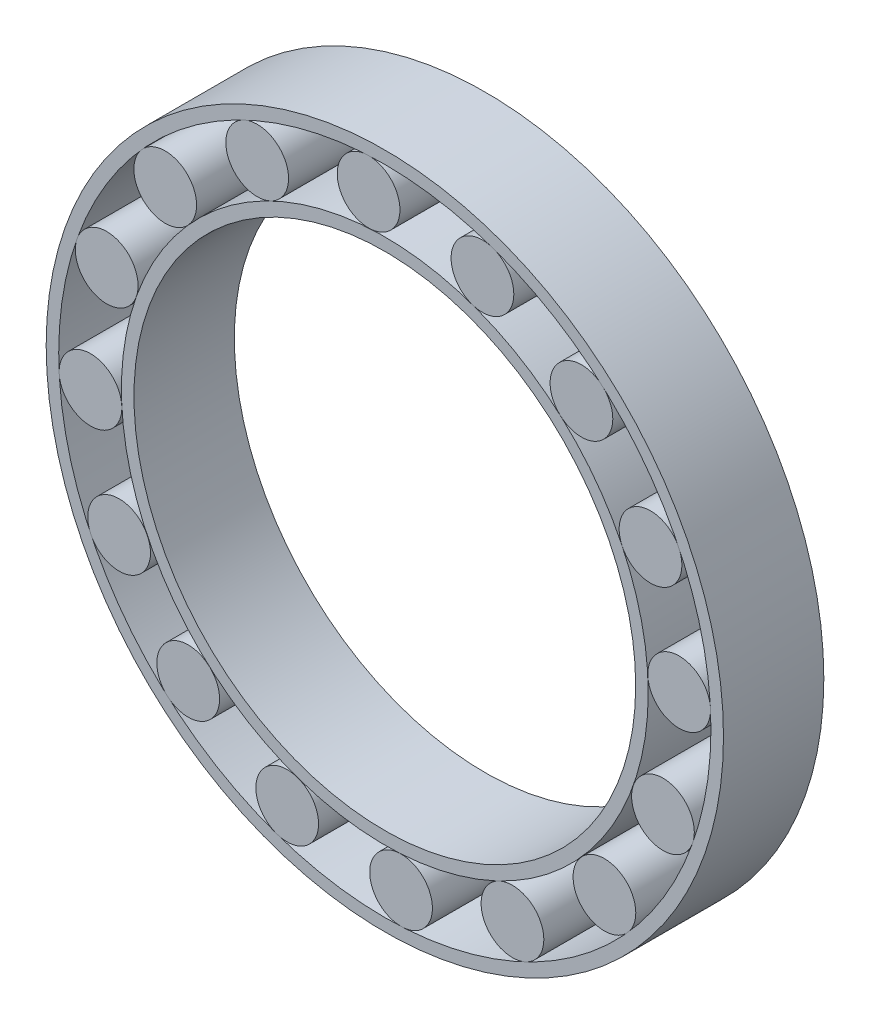
from build123d import *

# Parameters (mm, degrees)
IZIM1_R                        = 13.5
Y_KSEKLIK_EKSTR_ZYON1_DEPTH    = 4
Y_KSEKLIK_EKSTR_ZYON1_2_DEPTH  = 4
Y_KSEKLIK_EKSTR_ZYON1_3_DEPTH  = 4
Y_KSEKLIK_EKSTR_ZYON1_4_DEPTH  = 4
IZIM1_R_2                      = 10
Y_KSEKLIK_EKSTR_ZYON1_5_DEPTH  = 4
Y_KSEKLIK_EKSTR_ZYON1_6_DEPTH  = 4
Y_KSEKLIK_EKSTR_ZYON1_7_DEPTH  = 4
Y_KSEKLIK_EKSTR_ZYON1_8_DEPTH  = 4
Y_KSEKLIK_EKSTR_ZYON1_9_DEPTH  = 4
Y_KSEKLIK_EKSTR_ZYON1_10_DEPTH = 4
Y_KSEKLIK_EKSTR_ZYON1_11_DEPTH = 4
Y_KSEKLIK_EKSTR_ZYON1_12_DEPTH = 4
Y_KSEKLIK_EKSTR_ZYON1_13_DEPTH = 4
Y_KSEKLIK_EKSTR_ZYON1_14_DEPTH = 4
Y_KSEKLIK_EKSTR_ZYON1_15_DEPTH = 4
Y_KSEKLIK_EKSTR_ZYON1_16_DEPTH = 4
Y_KSEKLIK_EKSTR_ZYON1_17_DEPTH = 4
Y_KSEKLIK_EKSTR_ZYON1_18_DEPTH = 4


with BuildPart() as part:
    # Çizim1 → Yükseklik-Ekstrüzyon1 (new body)
    with BuildSketch(Plane.XY):
        Circle(IZIM1_R)
        with BuildLine():
            ThreePointArc((12.980252239, 0.716276353), (12.870578905, -1.829808363), (12.266296412, -4.305574565))
            ThreePointArc((12.266296412, -4.305574565), (11.190627017, -6.615879908), (9.684908089, -8.671940689))
            ThreePointArc((9.684908089, -8.671940689), (7.807003598, -10.394743615), (5.629080339, -11.718082375))
            ThreePointArc((5.629080339, -11.718082375), (3.23483472, -12.591101792), (0.716276221, -12.980252246))
            ThreePointArc((0.716276221, -12.980252246), (-1.82980833, -12.87057891), (-4.305574379, -12.266296477))
            ThreePointArc((-4.305574379, -12.266296477), (-6.6158796, -11.1906272), (-8.671940302, -9.684908435))
            ThreePointArc((-8.671940302, -9.684908435), (-10.394743214, -7.807004131), (-11.718082022, -5.629081073))
            ThreePointArc((-11.718082022, -5.629081073), (-12.591101342, -3.234836472), (-12.980252092, -0.716279021))
            ThreePointArc((-12.980252092, -0.716279021), (-12.870579206, 1.82980625), (-12.266296941, 4.305573058))
            ThreePointArc((-12.266296941, 4.305573058), (-11.190627945, 6.615878339), (-9.684909456, 8.671939162))
            ThreePointArc((-9.684909456, 8.671939162), (-7.807005145, 10.394742453), (-5.62908198, 11.718081586))
            ThreePointArc((-5.62908198, 11.718081586), (-3.234836528, 12.591101327), (-0.716278131, 12.980252141))
            ThreePointArc((-0.716278131, 12.980252141), (1.829806548, 12.870579163), (4.305572785, 12.266297037))
            ThreePointArc((4.305572785, 12.266297037), (6.615878752, 11.190627701), (8.671940094, 9.684908622))
            ThreePointArc((8.671940094, 9.684908622), (10.394743234, 7.807004105), (11.718082172, 5.629080761))
            ThreePointArc((11.718082172, 5.629080761), (12.591101717, 3.234835011), (12.980252239, 0.716276353))
        make_face(mode=Mode.SUBTRACT)
    extrude(amount=Y_KSEKLIK_EKSTR_ZYON1_DEPTH)


with BuildPart() as body_2:
    # Çizim1 → Y_kseklik-Ekstr_zyon1 2 (new body)
    with BuildSketch(Plane.XY):
        with BuildLine():
            ThreePointArc((12.980252239, 0.716276353), (11.663278967, 1.895506486), (10.484049806, 0.578532345))
            ThreePointArc((10.484049806, 0.578532345), (11.801022976, -0.600695947), (12.980252239, 0.716276353))
        make_face()
    extrude(amount=Y_KSEKLIK_EKSTR_ZYON1_2_DEPTH)


with BuildPart() as body_3:
    # Çizim1 → Y_kseklik-Ekstr_zyon1 3 (new body)
    with BuildSketch(Plane.XY):
        with BuildLine():
            ThreePointArc((12.266296412, -4.305574565), (11.500844036, -2.712124118), (9.907393997, -3.477577345))
            ThreePointArc((9.907393997, -3.477577345), (10.672846815, -5.071026532), (12.266296412, -4.305574565))
        make_face()
    extrude(amount=Y_KSEKLIK_EKSTR_ZYON1_3_DEPTH)


with BuildPart() as body_4:
    # Çizim1 → Y_kseklik-Ekstr_zyon1 4 (new body)
    with BuildSketch(Plane.XY):
        with BuildLine():
            ThreePointArc((11.718082172, 5.629080761), (10.050085674, 6.214563218), (9.464604297, 4.546566341))
            ThreePointArc((9.464604297, 4.546566341), (11.132600094, 3.961085343), (11.718082172, 5.629080761))
        make_face()
    extrude(amount=Y_KSEKLIK_EKSTR_ZYON1_4_DEPTH)


with BuildPart() as body_5:
    # Çizim1 → Y_kseklik-Ekstr_zyon1 5 (new body)
    with BuildSketch(Plane.XY):
        with BuildLine():
            ThreePointArc((9.907393997, -3.477577345), (10.395467837, -1.477920315), (10.484049806, 0.578532345))
            ThreePointArc((10.484049806, 0.578532345), (10.169735669, 2.612752652), (9.464604297, 4.546566341))
            ThreePointArc((9.464604297, 4.546566341), (8.395753486, 6.305658046), (7.004258577, 7.822426848))
            ThreePointArc((7.004258577, 7.822426848), (5.343593908, 9.038584189), (3.477577915, 9.907393797))
            ThreePointArc((3.477577915, 9.907393797), (1.477920644, 10.39546779), (-0.578532286, 10.484049809))
            ThreePointArc((-0.578532286, 10.484049809), (-2.61275317, 10.169735536), (-4.546567359, 9.464603809))
            ThreePointArc((-4.546567359, 9.464603809), (-6.305657937, 8.395753568), (-7.822425914, 7.00425962))
            ThreePointArc((-7.822425914, 7.00425962), (-9.038584255, 5.343593796), (-9.907394347, 3.477576348))
            ThreePointArc((-9.907394347, 3.477576348), (-10.395468046, 1.477918845), (-10.4840497, -0.578534256))
            ThreePointArc((-10.4840497, -0.578534256), (-10.169735674, -2.612752632), (-9.464605144, -4.546564578))
            ThreePointArc((-9.464605144, -4.546564578), (-8.395754665, -6.305656477), (-7.004260042, -7.822425535))
            ThreePointArc((-7.004260042, -7.822425535), (-5.343593943, -9.038584168), (-3.477576136, -9.907394421))
            ThreePointArc((-3.477576136, -9.907394421), (-1.4779188, -10.395468052), (0.578534122, -10.484049708))
            ThreePointArc((0.578534122, -10.484049708), (2.61275281, -10.169735629), (4.54656503, -9.464604927))
            ThreePointArc((4.54656503, -9.464604927), (6.305657937, -8.395753568), (7.822427637, -7.004257696))
            ThreePointArc((7.822427637, -7.004257696), (9.038584644, -5.343593139), (9.907393997, -3.477577345))
        make_face()
        Circle(IZIM1_R_2, mode=Mode.SUBTRACT)
    extrude(amount=Y_KSEKLIK_EKSTR_ZYON1_5_DEPTH)


with BuildPart() as body_6:
    # Çizim1 → Y_kseklik-Ekstr_zyon1 6 (new body)
    with BuildSketch(Plane.XY):
        with BuildLine():
            ThreePointArc((7.822427637, -7.004257696), (7.91982667, -8.76933908), (9.684908089, -8.671940689))
            ThreePointArc((9.684908089, -8.671940689), (9.587509663, -6.906858627), (7.822427637, -7.004257696))
        make_face()
    extrude(amount=Y_KSEKLIK_EKSTR_ZYON1_6_DEPTH)


with BuildPart() as body_7:
    # Çizim1 → Y_kseklik-Ekstr_zyon1 7 (new body)
    with BuildSketch(Plane.XY):
        with BuildLine():
            ThreePointArc((7.004258577, 7.822426848), (8.76933974, 7.919827408), (8.671940094, 9.684908622))
            ThreePointArc((8.671940094, 9.684908622), (6.906857967, 9.587508925), (7.004258577, 7.822426848))
        make_face()
    extrude(amount=Y_KSEKLIK_EKSTR_ZYON1_7_DEPTH)


with BuildPart() as body_8:
    # Çizim1 → Y_kseklik-Ekstr_zyon1 8 (new body)
    with BuildSketch(Plane.XY):
        with BuildLine():
            ThreePointArc((4.54656503, -9.464604927), (3.961085557, -11.132600539), (5.629080339, -11.718082375))
            ThreePointArc((5.629080339, -11.718082375), (6.214563004, -10.05008523), (4.54656503, -9.464604927))
        make_face()
    extrude(amount=Y_KSEKLIK_EKSTR_ZYON1_8_DEPTH)


with BuildPart() as body_9:
    # Çizim1 → Y_kseklik-Ekstr_zyon1 9 (new body)
    with BuildSketch(Plane.XY):
        with BuildLine():
            ThreePointArc((3.477577915, 9.907393797), (5.071026945, 10.67284799), (4.305572785, 12.266297037))
            ThreePointArc((4.305572785, 12.266297037), (2.712123705, 11.500842861), (3.477577915, 9.907393797))
        make_face()
    extrude(amount=Y_KSEKLIK_EKSTR_ZYON1_9_DEPTH)


with BuildPart() as body_10:
    # Çizim1 → Y_kseklik-Ekstr_zyon1 10 (new body)
    with BuildSketch(Plane.XY):
        with BuildLine():
            ThreePointArc((0.578534122, -10.484049708), (-0.600696, -11.801022021), (0.716276221, -12.980252246))
            ThreePointArc((0.716276221, -12.980252246), (1.895506539, -11.663279922), (0.578534122, -10.484049708))
        make_face()
    extrude(amount=Y_KSEKLIK_EKSTR_ZYON1_10_DEPTH)


with BuildPart() as body_11:
    # Çizim1 → Y_kseklik-Ekstr_zyon1 11 (new body)
    with BuildSketch(Plane.XY):
        with BuildLine():
            ThreePointArc((-0.578532286, 10.484049809), (0.600695896, 11.801023894), (-0.716278131, 12.980252141))
            ThreePointArc((-0.716278131, 12.980252141), (-1.895506436, 11.663278049), (-0.578532286, 10.484049809))
        make_face()
    extrude(amount=Y_KSEKLIK_EKSTR_ZYON1_11_DEPTH)


with BuildPart() as body_12:
    # Çizim1 → Y_kseklik-Ekstr_zyon1 12 (new body)
    with BuildSketch(Plane.XY):
        with BuildLine():
            ThreePointArc((-3.477576136, -9.907394421), (-5.071026353, -10.672846304), (-4.305574379, -12.266296477))
            ThreePointArc((-4.305574379, -12.266296477), (-2.712124297, -11.500844547), (-3.477576136, -9.907394421))
        make_face()
    extrude(amount=Y_KSEKLIK_EKSTR_ZYON1_12_DEPTH)


with BuildPart() as body_13:
    # Çizim1 → Y_kseklik-Ekstr_zyon1 13 (new body)
    with BuildSketch(Plane.XY):
        with BuildLine():
            ThreePointArc((-4.546567359, 9.464603809), (-3.961085392, 11.132600195), (-5.62908198, 11.718081586))
            ThreePointArc((-5.62908198, 11.718081586), (-6.214563169, 10.050085574), (-4.546567359, 9.464603809))
        make_face()
    extrude(amount=Y_KSEKLIK_EKSTR_ZYON1_13_DEPTH)


with BuildPart() as body_14:
    # Çizim1 → Y_kseklik-Ekstr_zyon1 14 (new body)
    with BuildSketch(Plane.XY):
        with BuildLine():
            ThreePointArc((-7.004260042, -7.822425535), (-8.769340303, -7.919828036), (-8.671940302, -9.684908435))
            ThreePointArc((-8.671940302, -9.684908435), (-6.906857404, -9.587508296), (-7.004260042, -7.822425535))
        make_face()
    extrude(amount=Y_KSEKLIK_EKSTR_ZYON1_14_DEPTH)


with BuildPart() as body_15:
    # Çizim1 → Y_kseklik-Ekstr_zyon1 15 (new body)
    with BuildSketch(Plane.XY):
        with BuildLine():
            ThreePointArc((-7.822425914, 7.00425962), (-7.919828395, 8.769340625), (-9.684909456, 8.671939162))
            ThreePointArc((-9.684909456, 8.671939162), (-9.587507937, 6.906857082), (-7.822425914, 7.00425962))
        make_face()
    extrude(amount=Y_KSEKLIK_EKSTR_ZYON1_15_DEPTH)


with BuildPart() as body_16:
    # Çizim1 → Y_kseklik-Ekstr_zyon1 16 (new body)
    with BuildSketch(Plane.XY):
        with BuildLine():
            ThreePointArc((-9.464605144, -4.546564578), (-11.132601132, -3.961085842), (-11.718082022, -5.629081073))
            ThreePointArc((-11.718082022, -5.629081073), (-10.050084637, -6.214562719), (-9.464605144, -4.546564578))
        make_face()
    extrude(amount=Y_KSEKLIK_EKSTR_ZYON1_16_DEPTH)


with BuildPart() as body_17:
    # Çizim1 → Y_kseklik-Ekstr_zyon1 17 (new body)
    with BuildSketch(Plane.XY):
        with BuildLine():
            ThreePointArc((-9.907394347, 3.477576348), (-10.672847071, 5.071026622), (-12.266296941, 4.305573058))
            ThreePointArc((-12.266296941, 4.305573058), (-11.500843781, 2.712124028), (-9.907394347, 3.477576348))
        make_face()
    extrude(amount=Y_KSEKLIK_EKSTR_ZYON1_17_DEPTH)


with BuildPart() as body_18:
    # Çizim1 → Y_kseklik-Ekstr_zyon1 18 (new body)
    with BuildSketch(Plane.XY):
        with BuildLine():
            ThreePointArc((-10.4840497, -0.578534256), (-11.801023354, 0.600695926), (-12.980252092, -0.716279021))
            ThreePointArc((-12.980252092, -0.716279021), (-11.663278589, -1.895506465), (-10.4840497, -0.578534256))
        make_face()
    extrude(amount=Y_KSEKLIK_EKSTR_ZYON1_18_DEPTH)


solid = Compound([part.part, body_2.part, body_3.part, body_4.part, body_5.part, body_6.part, body_7.part, body_8.part, body_9.part, body_10.part, body_11.part, body_12.part, body_13.part, body_14.part, body_15.part, body_16.part, body_17.part, body_18.part])
